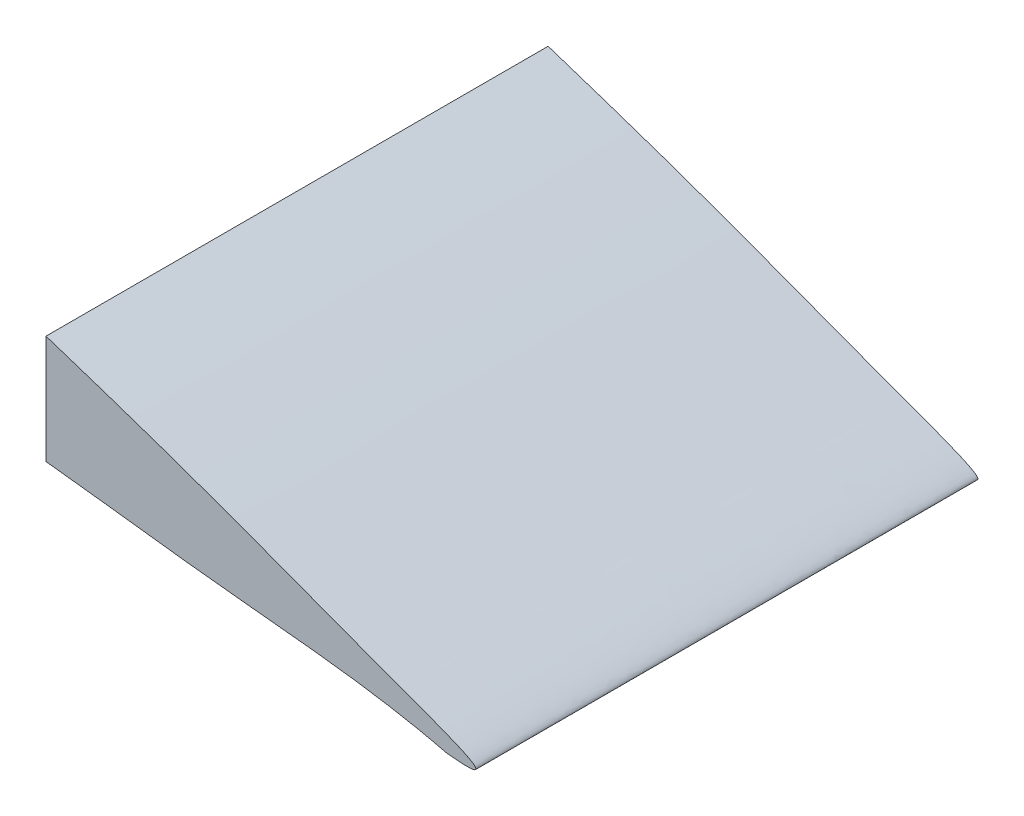
from build123d import *

# Parameters (mm, degrees)
BOSS_EXTRUDE1_DEPTH = 38.1
SKETCH2_R           = 6.35
SKETCH2_R_2         = 3.175
CUT_EXTRUDE1_DEPTH  = 319.018514003
SKETCH4_W           = 288.716015118
SKETCH4_H           = 117.489254048
CUT_EXTRUDE3_DEPTH  = 319.018514003


with BuildPart() as part:
    # Sketch1 → Boss-Extrude1 (new body)
    with BuildSketch(Plane.XY):
        with BuildLine():
            add(Edge.make_bspline(
                [(0.000560351, 0.000130087), (0.810633127, 7.359196055), (8.649092025, 17.856605174), (26.286719818, 29.975176328), (52.111128271, 42.069215275), (89.597618475, 49.290763054), (131.400792109, 47.884831915), (173.256699242, 40.041104278), (217.961060472, 29.612974894), (256.952064401, 19.528920948), (290.35983767, 8.71099439), (301.273197721, 4.382828139), (314.816918223, -0.516206742), (309.846313895, 0.000130087)],
                knots=[0, 0, 0, 0, 0.060863618, 0.113688265, 0.188608742, 0.312908923, 0.448482434, 0.557612135, 0.691544113, 0.852438279, 0.92975597, 0.976058229, 1, 1, 1, 1], degree=3))
            add(Edge.make_bspline(
                [(309.846313895, 0.000130087), (303.956832565, 1.47095521), (293.989507544, 2.093987313), (276.26402299, 4.514356704), (260.846344817, 5.427413394), (235.858814759, 7.870306192), (205.101424636, 8.838080282), (157.718638092, 9.030650149), (110.497331172, 6.181495223), (66.506197185, -0.586669107), (36.454672816, -6.098499901), (15.316603331, -6.189065841), (1.230714189, -6.924076091), (0.000560351, 0.000130087)],
                knots=[0, 0, 0, 0, 0.057787081, 0.095274891, 0.171021118, 0.205339302, 0.335319146, 0.464904334, 0.658702312, 0.785511947, 0.893517288, 0.94309214, 1, 1, 1, 1], degree=3))
        make_face()
    extrude(amount=BOSS_EXTRUDE1_DEPTH)

    # Sketch2 → Cut-Extrude1 (cut, through all)
    with BuildSketch(Plane.XY.offset(38.1)):
        with Locations((20.32, 10.16)):
            Circle(SKETCH2_R)
        with Locations((227.296313895, 19.050130087)):
            Circle(SKETCH2_R_2)
    extrude(amount=-CUT_EXTRUDE1_DEPTH, mode=Mode.SUBTRACT)

    # Sketch4 → Cut-Extrude3 (cut, through all)
    with BuildSketch(Plane.XY.offset(38.1)):
        with Locations((135.042552792, 34.528076629)):
            Rectangle(SKETCH4_W, SKETCH4_H)
    extrude(amount=-CUT_EXTRUDE3_DEPTH, mode=Mode.SUBTRACT)


solid = part.part
